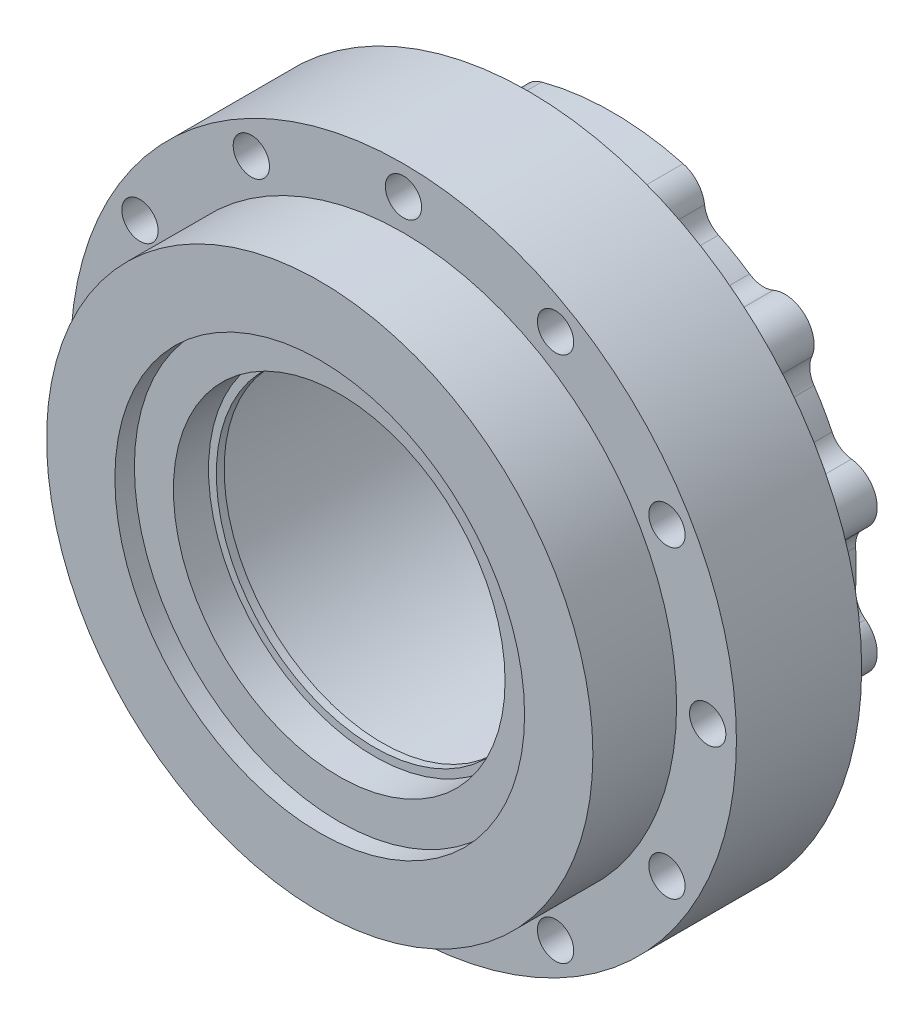
from build123d import *

# Parameters (mm, degrees)
SKETCH2_R                   = 4
CUT_EXTRUDE1_DEPTH          = 10
M10X1_25_TAPPED_HOLE1_D     = 8.8
M10X1_25_TAPPED_HOLE1_DEPTH = 14
M10X1_25_TAPPED_HOLE1_TIP   = 2.643786724
SKETCH7_W                   = 32.09110021
SKETCH7_H                   = 15.334740526
SKETCH8_R                   = 4.652226046
CUT_EXTRUDE2_DEPTH          = 133.027125309
CUT_EXTRUDE4_START          = -21.454449895
CUT_EXTRUDE4_DEPTH          = 21.454449895
FILLET1_R                   = 6.35
CHAMFER1_SIZE               = 0.5


with BuildPart() as part:
    # Sketch1 → Revolve1 (revolve)
    with BuildSketch(Plane(origin=(0, 0, 0), x_dir=(0, 0, -1), z_dir=(1, 0, 0)), mode=Mode.PRIVATE) as revolve1_sk:
        Polygon((-84.79575879, 52.5), (-79.79575879, 52.5), (-79.79575879, 42.5), (-70.79575879, 42.5), (-70.79575879, 40.5), (-68.79575879, 40.5), (-68.79575879, 55), (-9.79575879, 55), (-9.79575879, 70), (-84.79575879, 70), align=None)
    revolve(revolve1_sk.sketch.rotate(Axis((0, 0, 163.822734484), (0, 0, -1)), 90), axis=Axis((0, 0, 163.822734484), (0, 0, -1)))

    # Sketch2 → Cut-Extrude1 (cut)
    with BuildSketch(Plane(origin=(0, 0, 9.79575879), x_dir=(-1, 0, 0), z_dir=(0, 0, -1))):
        with Locations((0, 62.5)):
            Circle(SKETCH2_R)
        with Locations((0, -62.5)):
            Circle(SKETCH2_R)
    extrude(amount=-CUT_EXTRUDE1_DEPTH, mode=Mode.SUBTRACT)

    # M10x1.25 Tapped Hole1
    with Locations(Plane(origin=(0, 0, 9.79575879), x_dir=(1, 0, 0), z_dir=(0, 0, -1))):
        with Locations((-60.370364143, -16.176190319), (-44.194173824, -44.194173824), (44.194173824, -44.194173824), (-16.176190319, -60.370364143), (16.176190319, -60.370364143), (60.370364143, -16.176190319), (60.370364143, 16.176190319), (44.194173824, 44.194173824), (16.176190319, 60.370364143), (-16.176190319, 60.370364143), (-44.194173824, 44.194173824), (-60.370364143, 16.176190319)):
            Hole(M10X1_25_TAPPED_HOLE1_D / 2, depth=M10X1_25_TAPPED_HOLE1_DEPTH)
            with Locations((0, 0, -(M10X1_25_TAPPED_HOLE1_DEPTH + M10X1_25_TAPPED_HOLE1_TIP / 2))):  # 118° drill point
                Cone(0, M10X1_25_TAPPED_HOLE1_D / 2, M10X1_25_TAPPED_HOLE1_TIP, mode=Mode.SUBTRACT)

    # Sketch7 → Revolve2 (revolve)
    with BuildSketch(Plane(origin=(0, 0, 0), x_dir=(0, 0, -1), z_dir=(1, 0, 0)), mode=Mode.PRIVATE) as revolve2_sk:
        with Locations((-47.29575879, 77.667370263)):
            Rectangle(SKETCH7_W, SKETCH7_H)
    revolve(revolve2_sk.sketch.rotate(Axis((0, 0, 163.822734484), (0, 0, -1)), 90), axis=Axis((0, 0, 163.822734484), (0, 0, -1)))

    # Sketch8 → Cut-Extrude2 (cut, through all)
    with BuildSketch(Plane(origin=(0, 0, 31.250208685), x_dir=(-1, 0, 0), z_dir=(0, 0, -1))):
        with Locations((0, 77.969134613)):
            Circle(SKETCH8_R)
        with Locations((38.984567307, 67.523251286)):
            Circle(SKETCH8_R)
        with Locations((67.523251286, 38.984567307)):
            Circle(SKETCH8_R)
        with Locations((77.969134613, 0)):
            Circle(SKETCH8_R)
        with Locations((67.523251286, -38.984567307)):
            Circle(SKETCH8_R)
        with Locations((38.984567307, -67.523251286)):
            Circle(SKETCH8_R)
        with Locations((0, -77.969134613)):
            Circle(SKETCH8_R)
        with Locations((-38.984567307, -67.523251286)):
            Circle(SKETCH8_R)
        with Locations((-67.523251286, -38.984567307)):
            Circle(SKETCH8_R)
        with Locations((-77.969134613, 0)):
            Circle(SKETCH8_R)
        with Locations((-67.523251286, 38.984567307)):
            Circle(SKETCH8_R)
        with Locations((-38.984567307, 67.523251286)):
            Circle(SKETCH8_R)
    extrude(amount=-CUT_EXTRUDE2_DEPTH, mode=Mode.SUBTRACT)

    # Sketch9 → Cut-Extrude4 (cut)
    with BuildSketch(Plane(origin=(0, 0, 9.79575879), x_dir=(-1, 0, 0), z_dir=(0, 0, -1)).offset(CUT_EXTRUDE4_START)):
        with BuildLine():
            ThreePointArc((-49.497474608, 49.497474758), (-43.969072362, 51.690795019), (-38.582229462, 49.169722083))
            ThreePointArc((-38.582229462, 49.169722083), (-31.25, 54.126587737), (-23.29111369, 57.99805189))
            ThreePointArc((-23.29111369, 57.99805189), (-22.781005332, 63.923731368), (-18.117332792, 67.614807938))
            ThreePointArc((-18.117332792, 67.614807938), (-34.99999979, 60.621778386), (-49.497474608, 49.497474758))
        make_face()
        with BuildLine():
            ThreePointArc((49.497474756, 49.49747461), (34.999999999, 60.621778266), (18.117333054, 67.614807868))
            ThreePointArc((18.117333054, 67.614807868), (22.781005397, 63.923731249), (23.29111369, 57.99805189))
            ThreePointArc((23.29111369, 57.99805189), (31.25, 54.126587737), (38.582229462, 49.169722083))
            ThreePointArc((38.582229462, 49.169722083), (43.969072466, 51.690795022), (49.497474756, 49.49747461))
        make_face()
        with BuildLine():
            ThreePointArc((-49.169722083, 38.582229462), (-51.690795022, 43.969072467), (-49.497474608, 49.497474758))
            ThreePointArc((-49.497474608, 49.497474758), (-60.621778281, 34.999999972), (-67.614807884, 18.117332992))
            ThreePointArc((-67.614807884, 18.117332992), (-63.923731277, 22.781005382), (-57.99805189, 23.29111369))
            ThreePointArc((-57.99805189, 23.29111369), (-54.126587737, 31.25), (-49.169722083, 38.582229462))
        make_face()
        with BuildLine():
            ThreePointArc((-61.873343152, 8.828329807), (-66.750077792, 12.232936109), (-67.614807884, 18.117332992))
            ThreePointArc((-67.614807884, 18.117332992), (-70, -3.2e-08), (-67.614807868, -18.117333054))
            ThreePointArc((-67.614807868, -18.117333054), (-66.750077808, -12.232936136), (-61.873343152, -8.828329807))
            ThreePointArc((-61.873343152, -8.828329807), (-62.5, 0), (-61.873343152, 8.828329807))
        make_face()
        with BuildLine():
            ThreePointArc((67.614807884, 18.117332992), (60.621778334, 34.999999881), (49.497474756, 49.49747461))
            ThreePointArc((49.497474756, 49.49747461), (51.690795019, 43.969072363), (49.169722083, 38.582229462))
            ThreePointArc((49.169722083, 38.582229462), (54.126587737, 31.25), (57.99805189, 23.29111369))
            ThreePointArc((57.99805189, 23.29111369), (63.923731277, 22.781005382), (67.614807884, 18.117332992))
        make_face()
        with BuildLine():
            ThreePointArc((70, 0), (69.401140307, 9.136833371), (67.614807884, 18.117332992))
            ThreePointArc((67.614807884, 18.117332992), (66.750077792, 12.232936109), (61.873343152, 8.828329807))
            ThreePointArc((61.873343152, 8.828329807), (62.5, 0), (61.873343152, -8.828329807))
            ThreePointArc((61.873343152, -8.828329807), (66.750077897, -12.232936279), (67.614807781, -18.117333379))
            ThreePointArc((67.614807781, -18.117333379), (69.401140281, -9.136833569), (70, 0))
        make_face()
        with BuildLine():
            ThreePointArc((49.497474683, -49.497474683), (60.621778208, -35.000000099), (67.614807781, -18.117333379))
            ThreePointArc((67.614807781, -18.117333379), (63.923731101, -22.781005476), (57.99805189, -23.29111369))
            ThreePointArc((57.99805189, -23.29111369), (54.126587737, -31.25), (49.169722083, -38.582229462))
            ThreePointArc((49.169722083, -38.582229462), (51.69079502, -43.969072414), (49.497474683, -49.497474683))
        make_face()
        with BuildLine():
            ThreePointArc((23.29111369, -57.99805189), (22.781005357, -63.923731323), (18.117332892, -67.614807911))
            ThreePointArc((18.117332892, -67.614807911), (34.999999881, -60.621778334), (49.497474683, -49.497474683))
            ThreePointArc((49.497474683, -49.497474683), (43.969072414, -51.69079502), (38.582229462, -49.169722083))
            ThreePointArc((38.582229462, -49.169722083), (31.25, -54.126587737), (23.29111369, -57.99805189))
        make_face()
        with BuildLine():
            ThreePointArc((-38.582229462, -49.169722083), (-43.969072411, -51.69079502), (-49.497474678, -49.497474688))
            ThreePointArc((-49.497474678, -49.497474688), (-34.999999951, -60.621778293), (-18.117333054, -67.614807868))
            ThreePointArc((-18.117333054, -67.614807868), (-22.781005397, -63.923731249), (-23.29111369, -57.99805189))
            ThreePointArc((-23.29111369, -57.99805189), (-31.25, -54.126587737), (-38.582229462, -49.169722083))
        make_face()
        with BuildLine():
            ThreePointArc((-57.99805189, -23.29111369), (-63.923731249, -22.781005397), (-67.614807868, -18.117333054))
            ThreePointArc((-67.614807868, -18.117333054), (-60.62177829, -34.999999957), (-49.497474678, -49.497474688))
            ThreePointArc((-49.497474678, -49.497474688), (-51.69079502, -43.969072418), (-49.169722083, -38.582229462))
            ThreePointArc((-49.169722083, -38.582229462), (-54.126587737, -31.25), (-57.99805189, -23.29111369))
        make_face()
    extrude(amount=CUT_EXTRUDE4_DEPTH, mode=Mode.SUBTRACT)

    # Fillet1
    fillet1_edges = [part.edges().sort_by_distance(p)[0] for p in [
        (-49.169722083, -38.582229462, 20.522983737),
        (-57.99805189, -23.29111369, 20.522983737),
        (23.29111369, 57.99805189, 20.522983737),
        (38.582229462, 49.169722083, 20.522983737),
        (61.873343152, 8.828329807, 20.522983737),
        (61.873343152, -8.828329807, 20.522983737),
        (-57.99805189, 23.29111369, 20.522983737),
        (-49.169722083, 38.582229462, 20.522983737),
        (-38.582229462, 49.169722083, 20.522983737),
        (-23.29111369, 57.99805189, 20.522983737),
        (49.169722083, 38.582229462, 20.522983737),
        (57.99805189, 23.29111369, 20.522983737),
        (-61.873343152, -8.828329807, 20.522983737),
        (-61.873343152, 8.828329807, 20.522983737),
        (-23.29111369, -57.99805189, 20.522983737),
        (-38.582229462, -49.169722083, 20.522983737),
        (38.582229462, -49.169722083, 20.522983737),
        (23.29111369, -57.99805189, 20.522983737),
        (57.99805189, -23.29111369, 20.522983737),
        (49.169722083, -38.582229462, 20.522983737),
    ]]
    fillet(fillet1_edges, radius=FILLET1_R)

    # Chamfer1
    chamfer1_edges = [part.edges().sort_by_distance(p)[0] for p in [
        (-11.776190319, 60.370364143, 9.79575879),
        (48.594173824, 44.194173824, 9.79575879),
        (-39.794173824, 44.194173824, 9.79575879),
        (-55.970364143, 16.176190319, 9.79575879),
        (-55.970364143, -16.176190319, 9.79575879),
        (-39.794173824, -44.194173824, 9.79575879),
        (-11.776190319, -60.370364143, 9.79575879),
        (20.576190319, -60.370364143, 9.79575879),
        (48.594173824, -44.194173824, 9.79575879),
        (64.770364143, -16.176190319, 9.79575879),
        (64.770364143, 16.176190319, 9.79575879),
        (20.576190319, 60.370364143, 9.79575879),
    ]]
    chamfer(chamfer1_edges, length=CHAMFER1_SIZE)


solid = part.part
